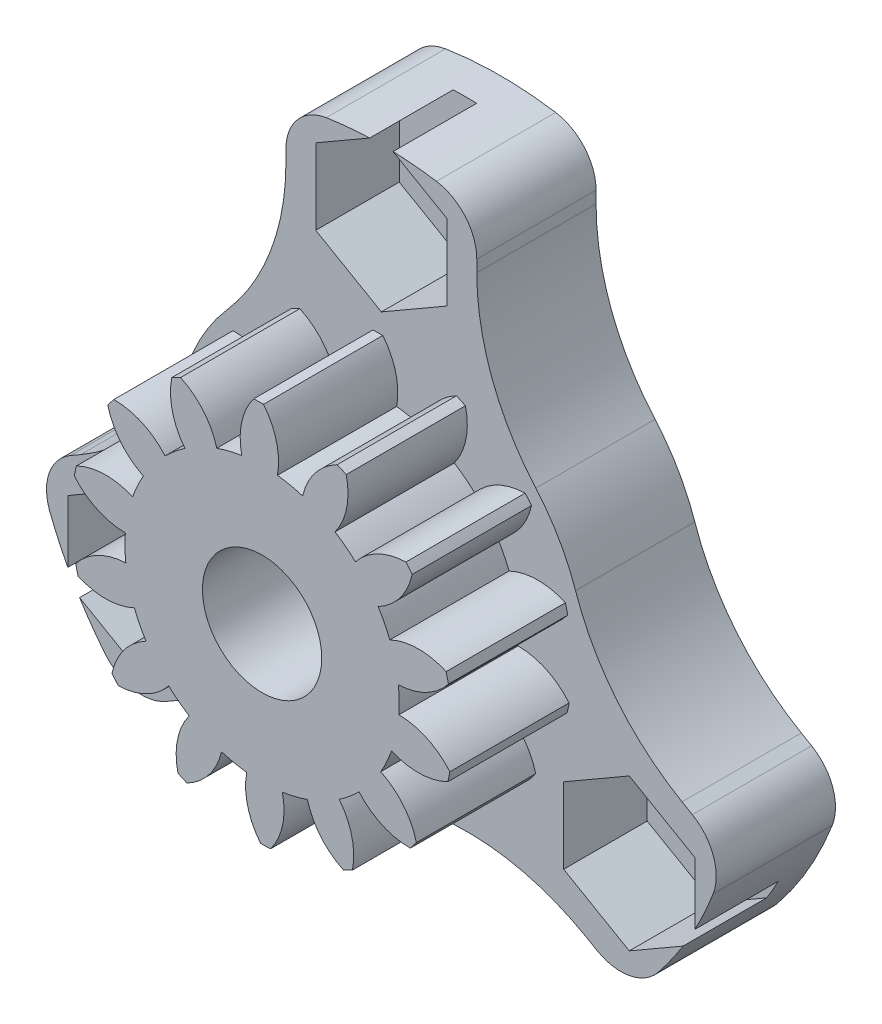
from build123d import *

# Parameters (mm, degrees)
SKETCH1_R           = 14.9
SKETCH1_R_2         = 1.6000000000000003
SKETCH1_R_3         = 1.6000000000006653
SKETCH1_R_4         = 1.6000000000009684
SKETCH1_R_5         = 2.5
BOSS_EXTRUDE1_DEPTH = 5
CUT_EXTRUDE1_DEPTH  = 3.5
CUT_EXTRUDE2_DEPTH  = 22.656869579881576
FILLET1_R           = 10
FILLET2_R           = 2
SKETCH6_R           = 2.4999999999999956
BOSS_EXTRUDE2_DEPTH = 5


with BuildPart() as part:
    # Sketch1 → Boss-Extrude1 (new body)
    with BuildSketch(Plane.XY):
        Circle(SKETCH1_R)
        with Locations((0, 12)):
            Circle(SKETCH1_R_2, mode=Mode.SUBTRACT)
        with Locations((10.392304845414033, -5.99999999999955)):
            Circle(SKETCH1_R_3, mode=Mode.SUBTRACT)
        with Locations((-10.3923048454125, -6.000000000000447)):
            Circle(SKETCH1_R_4, mode=Mode.SUBTRACT)
        Circle(SKETCH1_R_5, mode=Mode.SUBTRACT)
    extrude(amount=BOSS_EXTRUDE1_DEPTH)

    # Sketch2 → Cut-Extrude1 (cut)
    with BuildSketch(Plane.XY.offset(5)):
        Polygon((13.142304845413232, -7.5877132402708165), (13.142304845413246, -4.412286759728591), (10.392304845413825, -2.824573519457418), (7.642304845414409, -4.41228675972855), (7.64230484541441, -7.587713240270817), (10.39230484541382, -9.17542648054195), align=None)
        Polygon((1.342e-14, 15.175426480542264), (-2.749999999999405, 13.58771324027113), (-2.7499999999994076, 10.412286759728874), (9e-15, 8.824573519457736), (2.7499999999994245, 10.41228675972887), (2.7499999999994267, 13.58771324027113), align=None)
        Polygon((-13.14230484541212, -7.587713240271449), (-10.3923048454127, -9.175426480542583), (-7.642304845413332, -7.587713240271399), (-7.642304845413293, -4.412286759729188), (-10.392304845412706, -2.8245735194580552), (-13.142304845412118, -4.4122867597291835), align=None)
    extrude(amount=-CUT_EXTRUDE1_DEPTH, mode=Mode.SUBTRACT)

    # Sketch5 → Cut-Extrude2 (cut, through all)
    with BuildSketch(Plane.XY.offset(5)):
        with BuildLine():
            Line((4, 14.353048456686821), (4, 7.613146524269713))
            ThreePointArc((4, 7.613146524269714), (7.360706487831178, 4.447471191587419), (8.600000000000001, 0))
            ThreePointArc((8.600000000000001, 0), (8.598294404056443, -0.17126979059858147), (8.593178292750771, -0.3424716469971399))
            Line((8.593178292750771, -0.3424716469971399), (14.430104585239802, -3.712422613205722))
            ThreePointArc((14.430104585239803, -3.712422613205722), (12.903778516388154, 7.44999999999997), (4.000000000000001, 14.353048456686825))
        make_face()
        with BuildLine():
            Line((-14.43010458523985, -3.712422613205522), (-8.593178292750776, -0.3424716469970228))
            ThreePointArc((-8.593178292750778, -0.3424716469970228), (-7.447818472546155, 4.300000000000037), (-4.000000000000002, 7.613146524269715))
            Line((-4, 7.613146524269713), (-4, 14.353048456686821))
            ThreePointArc((-3.9999999999999996, 14.35304845668682), (-12.903778516388101, 7.450000000000059), (-14.43010458523985, -3.712422613205523))
        make_face()
        with BuildLine():
            ThreePointArc((4.593178292750738, -7.270674877272635), (-6.195e-14, -8.6), (-4.593178292750841, -7.270674877272569))
            Line((-4.59317829275084, -7.270674877272568), (-10.43010458523992, -10.640625843481063))
            ThreePointArc((-10.430104585239919, -10.640625843481068), (-1.0303e-13, -14.899999999999999), (10.430104585239771, -10.640625843481217))
            Line((10.430104585239768, -10.640625843481212), (4.593178292750737, -7.270674877272635))
        make_face()
    extrude(amount=-CUT_EXTRUDE2_DEPTH, mode=Mode.SUBTRACT)

    # Fillet1
    fillet1_edges = [part.edges().sort_by_distance(p)[0] for p in [
        (4.593178292750738, -7.270674877272635, 2.5),
        (-4.593178292750841, -7.270674877272569, 2.5),
        (-4.000000000000001, 7.613146524269714, 2.5),
        (-8.593178292750778, -0.3424716469970228, 2.5),
        (4.000000000000001, 7.613146524269715, 2.5),
        (8.593178292750771, -0.3424716469971399, 2.5),
    ]]
    fillet(fillet1_edges, radius=FILLET1_R)

    # Fillet2
    fillet2_edges = [part.edges().sort_by_distance(p)[0] for p in [
        (10.430104585239771, -10.640625843481214, 2.5),
        (-10.43010458523992, -10.640625843481068, 2.5),
        (-14.43010458523985, -3.7124226132055225, 2.5),
        (-4, 14.353048456686821, 2.5),
        (4, 14.353048456686823, 2.5),
        (14.430104585239803, -3.712422613205722, 2.5),
    ]]
    fillet(fillet2_edges, radius=FILLET2_R)

    # Sketch6 → Boss-Extrude2 (add)
    with BuildSketch(Plane.XY.offset(5)):
        with BuildLine():
            ThreePointArc((6.02817063707193, 5.259387680171888), (4.855499076696584, 4.968349486507053), (3.914637171074405, 4.2102988989907315))
            ThreePointArc((3.914637171074405, 4.2102988989907315), (3.5015459862118337, 4.559624623414058), (3.0574479574494795, 4.868574019924936))
            ThreePointArc((3.0574479574494795, 4.868574019924936), (3.547016405974829, 5.9731936616538555), (3.5255692044436264, 7.181250711726956))
            ThreePointArc((3.5255692044436264, 7.181250711726956), (3.3385186822805317, 7.270095804600103), (3.1492312822635022, 7.354069780115842))
            ThreePointArc((3.1492312822635022, 7.354069780115842), (2.2189674537840838, 6.583050306880795), (1.7001859911750001, 5.491845645628829))
            ThreePointArc((1.7001859911750001, 5.491845645628829), (1.1764369425261552, 5.627343700207033), (0.6422703249581851, 5.713010574966424))
            ThreePointArc((0.6422703249581851, 5.713010574966424), (0.6040797553307691, 6.9206542720378605), (0.06060018449448659, 7.999770472809791))
            ThreePointArc((0.06060018449448659, 7.999770472809791), (-0.1464749537974085, 7.998658955594381), (-0.3534519507842858, 7.992188168360838))
            ThreePointArc((-0.3534519507842858, 7.992188168360838), (-0.8570578872002823, 6.893897278163069), (-0.8510078756894319, 5.685665009083339))
            ThreePointArc((-0.8510078756894319, 5.685665009083339), (-1.3816798656790947, 5.580498342332617), (-1.9001168223196914, 5.425915320159152))
            ThreePointArc((-1.9001168223196914, 5.425915320159152), (-2.4585022994085572, 6.497394427590124), (-3.4163714452062757, 7.233837581006314))
            ThreePointArc((-3.4163714452062757, 7.233837581006314), (-3.6024574288783424, 7.14298960331872), (-3.7861296901755246, 7.047355672106486))
            ThreePointArc((-3.7861296901755246, 7.047355672106486), (-3.7633324024994224, 5.8393233454034945), (-3.233649195846893, 4.753368687383592))
            ThreePointArc((-3.233649195846893, 4.753368687383592), (-3.6661380312950715, 4.428366847438451), (-4.066162529533613, 4.064150991709943))
            ThreePointArc((-4.066162529533613, 4.064150991709943), (-5.034147822198015, 4.787245931444861), (-6.216688811137787, 5.035154439088672))
            ThreePointArc((-6.216688811137787, 5.035154439088672), (-6.344929028928957, 4.8725635570872505), (-6.468918010594077, 4.7067079548461095))
            ThreePointArc((-6.468918010594077, 4.7067079548461095), (-5.9242327812405176, 3.628199809485637), (-4.975826634662063, 2.879609400906265))
            ThreePointArc((-4.975826634662063, 2.879609400906265), (-5.224472597580759, 2.3991429880538346), (-5.426854879562582, 1.897431715811644))
            ThreePointArc((-5.426854879562582, 1.897431715811644), (-6.61271862902979, 2.1289246668585444), (-7.785714715338611, 1.8391972083928103))
            ThreePointArc((-7.785714715338611, 1.8391972083928103), (-7.83070961935227, 1.637066540304308), (-7.8704577829414815, 1.4338390031436454))
            ThreePointArc((-7.8704577829414815, 1.4338390031436454), (-6.911766201709898, 0.6984668043486959), (-5.7324805839734525, 0.43550815648784985))
            ThreePointArc((-5.7324805839734525, 0.43550815648784985), (-5.748036291964011, -0.1052605636725878), (-5.712692064686818, -0.6450971818759339))
            ThreePointArc((-5.712692064686818, -0.6450971818759339), (-6.881559411710404, -0.9510562375466041), (-7.812684334641904, -1.7210355856986488))
            ThreePointArc((-7.812684334641904, -1.7210355856986488), (-7.765522132311889, -1.9226715820894416), (-7.713156866547124, -2.1230193480128765))
            ThreePointArc((-7.713156866547124, -2.1230193480128765), (-6.530339558681069, -2.3696061175227916), (-5.353746449368295, -2.0948508194800826))
            ThreePointArc((-5.353746449368295, -2.0948508194800826), (-5.1331309036849415, -2.5888159698276345), (-4.867060524829484, -3.059856671095323))
            ThreePointArc((-4.867060524829484, -3.059856671095323), (-5.78742295611416, -3.842668790166433), (-6.292256005183971, -4.940396174926289))
            ThreePointArc((-6.292256005183971, -4.940396174926289), (-6.162277749088176, -5.101601017630917), (-6.028170637071975, -5.259387680171835))
            ThreePointArc((-6.028170637071975, -5.259387680171835), (-4.855499076696629, -4.968349486507008), (-3.9146371710744448, -4.210298898990695))
            ThreePointArc((-3.9146371710744448, -4.210298898990695), (-3.5015459862118763, -4.559624623414024), (-3.0574479574495212, -4.868574019924903))
            ThreePointArc((-3.0574479574495212, -4.868574019924903), (-3.5470164059748766, -5.973193661653813), (-3.525569204443685, -7.1812507117269115))
            ThreePointArc((-3.525569204443685, -7.1812507117269115), (-3.338518682280587, -7.2700958046000626), (-3.1492312822635578, -7.35406978011581))
            ThreePointArc((-3.1492312822635578, -7.35406978011581), (-2.218967453784133, -6.583050306880769), (-1.700185991175043, -5.491845645628806))
            ThreePointArc((-1.700185991175043, -5.491845645628806), (-1.176436942526202, -5.627343700207011), (-0.6422703249582338, -5.713010574966406))
            ThreePointArc((-0.6422703249582338, -5.713010574966406), (-0.6040797553308295, -6.920654272037842), (-0.06060018449455164, -7.999770472809773))
            ThreePointArc((-0.06060018449455164, -7.999770472809773), (0.14647495379734404, -7.998658955594365), (0.35345195078422115, -7.9921881683608245))
            ThreePointArc((0.35345195078422115, -7.9921881683608245), (0.8570578872002264, -6.893897278163062), (0.8510078756893855, -5.6856650090833325))
            ThreePointArc((0.8510078756893855, -5.6856650090833325), (1.3816798656790477, -5.580498342332614), (1.900116822319644, -5.425915320159157))
            ThreePointArc((1.900116822319644, -5.425915320159157), (2.458502299408505, -6.497394427590132), (3.416371445206218, -7.23383758100633))
            ThreePointArc((3.416371445206218, -7.23383758100633), (3.6024574288782856, -7.142989603318738), (3.7861296901754686, -7.047355672106509))
            ThreePointArc((3.7861296901754686, -7.047355672106509), (3.7633324024993775, -5.839323345403511), (3.2336491958468514, -4.753368687383601))
            ThreePointArc((3.2336491958468514, -4.753368687383601), (3.6661380312950302, -4.428366847438464), (4.066162529533574, -4.064150991709959))
            ThreePointArc((4.066162529533574, -4.064150991709959), (5.034147822197974, -4.7872459314448825), (6.216688811137743, -5.035154439088707))
            ThreePointArc((6.216688811137743, -5.035154439088707), (6.344929028928913, -4.872563557087289), (6.468918010594035, -4.706707954846148))
            ThreePointArc((6.468918010594035, -4.706707954846148), (5.924232781240482, -3.628199809485669), (4.975826634662032, -2.8796094009062863))
            ThreePointArc((4.975826634662032, -2.8796094009062863), (5.224472597580731, -2.3991429880538595), (5.426854879562554, -1.8974317158116716))
            ThreePointArc((5.426854879562554, -1.8974317158116716), (6.6127186290297635, -2.128924666858581), (7.7857147153385915, -1.8391972083928554))
            ThreePointArc((7.7857147153385915, -1.8391972083928554), (7.830709619352263, -1.6370665403042963), (7.870457782941487, -1.433839003143578))
            ThreePointArc((7.870457782941487, -1.433839003143578), (6.911766201709897, -0.6984668043486324), (5.732480583973447, -0.435508156487793))
            ThreePointArc((5.732480583973447, -0.435508156487793), (5.748036291964002, 0.10526056367264261), (5.7126920646868085, 0.6450971818759847))
            ThreePointArc((5.7126920646868085, 0.6450971818759847), (6.881559411710389, 0.9510562375466631), (7.81268433464188, 1.7210355856987143))
            ThreePointArc((7.81268433464188, 1.7210355856987143), (7.7655221323118635, 1.9226715820895108), (7.713156866547099, 2.123019348012948))
            ThreePointArc((7.713156866547099, 2.123019348012948), (6.530339558681042, 2.3696061175228524), (5.35374644936827, 2.094850819480135))
            ThreePointArc((5.35374644936827, 2.094850819480135), (5.133130903684914, 2.5888159698276865), (4.8670605248294505, 3.059856671095373))
            ThreePointArc((4.8670605248294505, 3.059856671095373), (5.787422956114117, 3.8426687901664893), (6.29225600518392, 4.940396174926349))
            ThreePointArc((6.29225600518392, 4.940396174926349), (6.162277749088128, 5.101601017630973), (6.02817063707193, 5.259387680171888))
        make_face()
        Circle(SKETCH6_R, mode=Mode.SUBTRACT)
    extrude(amount=BOSS_EXTRUDE2_DEPTH)


solid = part.part
